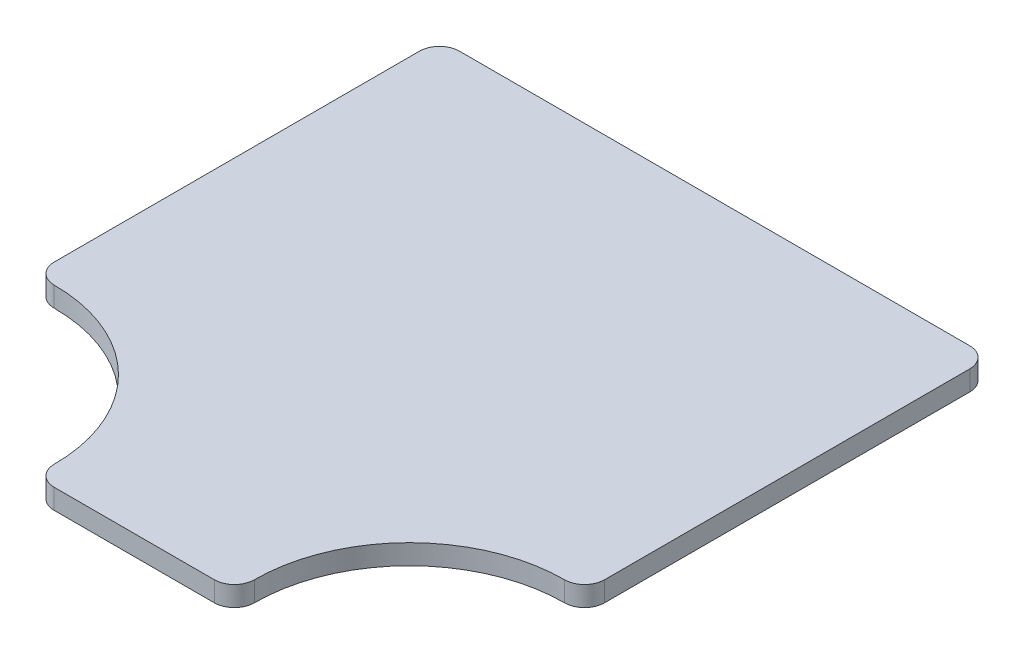
from build123d import *

# Parameters (mm, degrees)
SALIENTE_EXTRUIR1_DEPTH = 2


with BuildPart() as part:
    # Croquis1 → Saliente-Extruir1 (new body)
    with BuildSketch(Plane(origin=(0, 0, 0), x_dir=(1, 0, 0), z_dir=(0, 1, 0))):
        with BuildLine():
            Line((-41.528381643, 41.192203833), (9.471618357, 41.192203833))
            ThreePointArc((9.471618357, 41.192203833), (10.88583192, 40.606417395), (11.471618357, 39.192203833))
            Line((11.471618357, 39.192203833), (11.471618357, 2.692203833))
            ThreePointArc((11.471618357, 2.692203833), (10.88583192, 1.27799027), (9.471618357, 0.692203833))
            ThreePointArc((9.471618357, 0.692203833), (-1.488536751, -3.847641059), (-6.028381643, -14.807796167))
            ThreePointArc((-6.028381643, -14.807796167), (-6.61416808, -16.22200973), (-8.028381643, -16.807796167))
            Line((-8.028381643, -16.807796167), (-24.028381643, -16.807796167))
            ThreePointArc((-24.028381643, -16.807796167), (-25.442595205, -16.22200973), (-26.028381643, -14.807796167))
            ThreePointArc((-26.028381643, -14.807796167), (-30.568226534, -3.847641059), (-41.528381643, 0.692203833))
            ThreePointArc((-41.528381643, 0.692203833), (-42.942595205, 1.27799027), (-43.528381643, 2.692203833))
            Line((-43.528381643, 2.692203833), (-43.528381643, 39.192203833))
            ThreePointArc((-43.528381643, 39.192203833), (-42.942595205, 40.606417395), (-41.528381643, 41.192203833))
        make_face()
    extrude(amount=SALIENTE_EXTRUIR1_DEPTH)


solid = part.part
